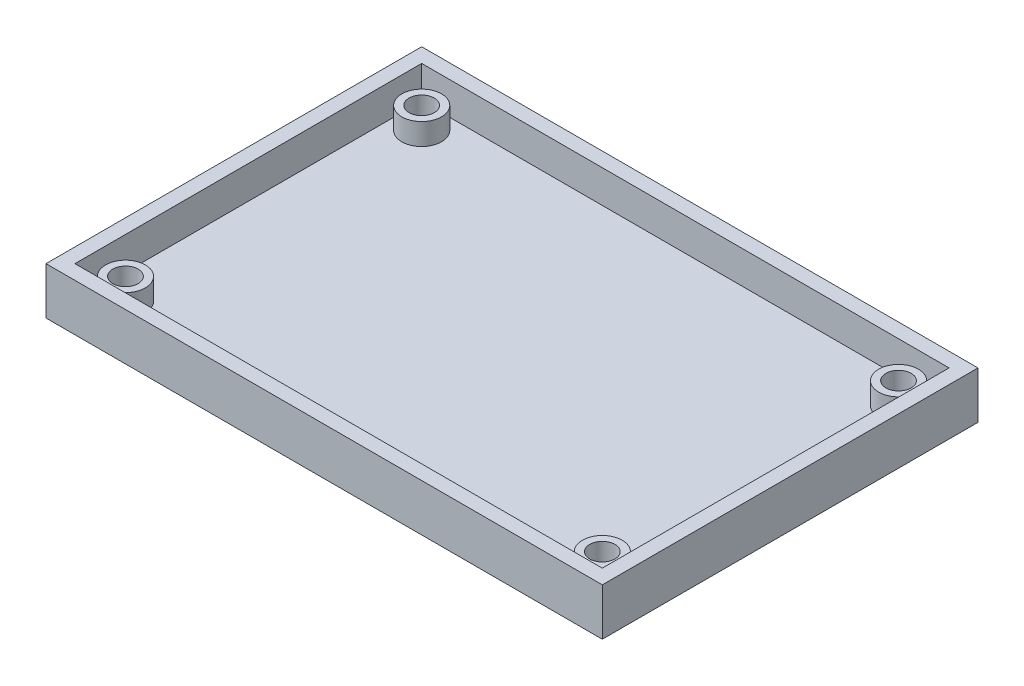
from build123d import *

# Parameters (mm, degrees)
SKETCH1_W           = 77
SKETCH1_H           = 52
SKETCH1_W_2         = 73
SKETCH1_H_2         = 48
BOSS_EXTRUDE1_DEPTH = 4.524
SKETCH2_W           = 77
SKETCH2_H           = 52
BOSS_EXTRUDE2_DEPTH = 2
SKETCH3_R           = 1.75
CUT_EXTRUDE1_DEPTH  = 2
BOSS_EXTRUDE3_START = 3
SKETCH4_R           = 2.75
SKETCH4_R_2         = 1.75
BOSS_EXTRUDE3_DEPTH = 3


with BuildPart() as part:
    # Sketch1 → Boss-Extrude1 (new body)
    with BuildSketch(Plane(origin=(0, 0, 0), x_dir=(1, 0, 0), z_dir=(0, 1, 0))):
        Rectangle(SKETCH1_W, SKETCH1_H)
        Rectangle(SKETCH1_W_2, SKETCH1_H_2, mode=Mode.SUBTRACT)
    extrude(amount=BOSS_EXTRUDE1_DEPTH)

    # Sketch2 → Boss-Extrude2 (add)
    with BuildSketch(Plane.XZ):
        Rectangle(SKETCH2_W, SKETCH2_H)
    extrude(amount=BOSS_EXTRUDE2_DEPTH)

    # Sketch3 → Cut-Extrude1 (cut)
    with BuildSketch(Plane(origin=(0, 0, 0), x_dir=(1, 0, 0), z_dir=(0, 1, 0))):
        with Locations(Location((-33, 20.5, 0), (0, 0, 270))):
            Circle(SKETCH3_R)
        with Locations(Location((33, 20.5, 0), (0, 0, 270))):
            Circle(SKETCH3_R)
        with Locations(Location((33, -20.5, 0), (0, 0, 270))):
            Circle(SKETCH3_R)
        with Locations(Location((-33, -20.5, 0), (0, 0, 270))):
            Circle(SKETCH3_R)
    extrude(amount=-CUT_EXTRUDE1_DEPTH, mode=Mode.SUBTRACT)

    # Sketch4 → Boss-Extrude3 (add)
    # profile 1 of 4: a face of its own
    with BuildSketch(Plane(origin=(0, 0, 0), x_dir=(1, 0, 0), z_dir=(0, 1, 0)).offset(BOSS_EXTRUDE3_START)):
        with Locations(Location((-33, -20.5, 0), (0, 0, 270))):
            Circle(SKETCH4_R)
        with Locations(Location((-33, -20.5, 0), (0, 0, 270))):
            Circle(SKETCH4_R_2, mode=Mode.SUBTRACT)
    # profile 2 of 4: a face of its own
    with BuildSketch(Plane(origin=(0, 0, 0), x_dir=(1, 0, 0), z_dir=(0, 1, 0)).offset(BOSS_EXTRUDE3_START)):
        with Locations(Location((33, -20.5, 0), (0, 0, 270))):
            Circle(SKETCH4_R)
        with Locations(Location((33, -20.5, 0), (0, 0, 270))):
            Circle(SKETCH4_R_2, mode=Mode.SUBTRACT)
    # profile 3 of 4: a face of its own
    with BuildSketch(Plane(origin=(0, 0, 0), x_dir=(1, 0, 0), z_dir=(0, 1, 0)).offset(BOSS_EXTRUDE3_START)):
        with Locations(Location((33, 20.5, 0), (0, 0, 270))):
            Circle(SKETCH4_R)
        with Locations(Location((33, 20.5, 0), (0, 0, 270))):
            Circle(SKETCH4_R_2, mode=Mode.SUBTRACT)
    # profile 4 of 4: a face of its own
    with BuildSketch(Plane(origin=(0, 0, 0), x_dir=(1, 0, 0), z_dir=(0, 1, 0)).offset(BOSS_EXTRUDE3_START)):
        with Locations(Location((-33, 20.5, 0), (0, 0, 270))):
            Circle(SKETCH4_R)
        with Locations(Location((-33, 20.5, 0), (0, 0, 270))):
            Circle(SKETCH4_R_2, mode=Mode.SUBTRACT)
    extrude(amount=-BOSS_EXTRUDE3_DEPTH)


solid = part.part
